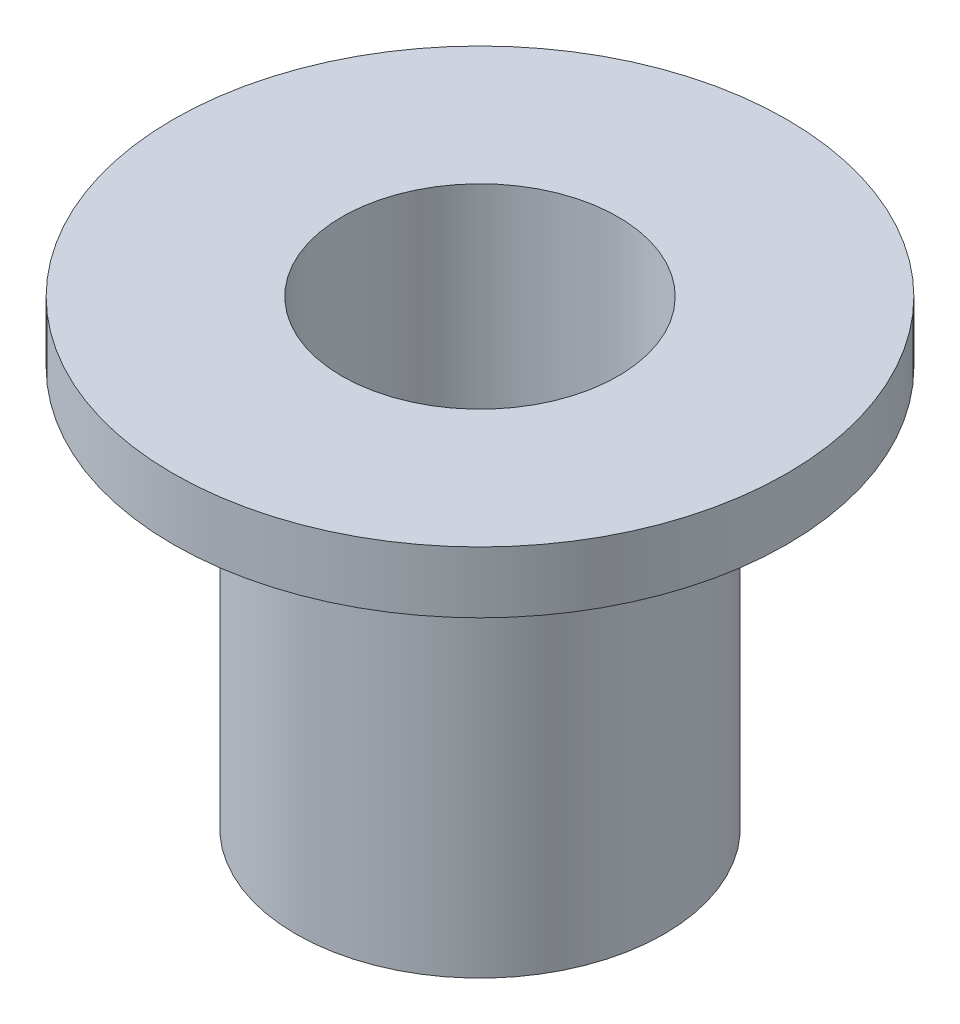
from build123d import *

# Parameters (mm, degrees)
ESQUISSE1_R             = 6
BOSS_EXTRU_1_DEPTH      = 15
ESQUISSE3_R             = 10
BOSS_EXTRU_2_DEPTH      = 2
ESQUISSE2_R             = 4.5
ENL_V_MAT_EXTRU_2_DEPTH = 13
ESQUISSE4_R             = 1.25
ENL_V_MAT_EXTRU_3_DEPTH = 20.209372712


with BuildPart() as part:
    # Esquisse1 → Boss.-Extru.1 (new body)
    with BuildSketch(Plane(origin=(0, 0, 0), x_dir=(1, 0, 0), z_dir=(0, 1, 0))):
        with Locations(Location((0, 0, 0), (0, 0, 270))):
            Circle(ESQUISSE1_R)
    extrude(amount=BOSS_EXTRU_1_DEPTH)

    # Esquisse3 → Boss.-Extru.2 (add)
    with BuildSketch(Plane(origin=(0, 15, 0), x_dir=(1, 0, 0), z_dir=(0, 1, 0))):
        with Locations(Location((0, 0, 0), (0, 0, 270))):
            Circle(ESQUISSE3_R)
    extrude(amount=-BOSS_EXTRU_2_DEPTH)

    # Esquisse2 → Enlèv. mat.-Extru.2 (cut)
    with BuildSketch(Plane(origin=(0, 15, 0), x_dir=(1, 0, 0), z_dir=(0, 1, 0))):
        with Locations(Location((0, 0, 0), (0, 0, 270))):
            Circle(ESQUISSE2_R)
    extrude(amount=-ENL_V_MAT_EXTRU_2_DEPTH, mode=Mode.SUBTRACT)

    # Esquisse4 → Enlèv. mat.-Extru.3 (cut, through all)
    with BuildSketch(Plane(origin=(0, 2, 0), x_dir=(1, 0, 0), z_dir=(0, 1, 0))):
        with Locations(Location((0, 0, 0), (0, 0, 270))):
            Circle(ESQUISSE4_R)
    extrude(amount=-ENL_V_MAT_EXTRU_3_DEPTH, mode=Mode.SUBTRACT)


solid = part.part
